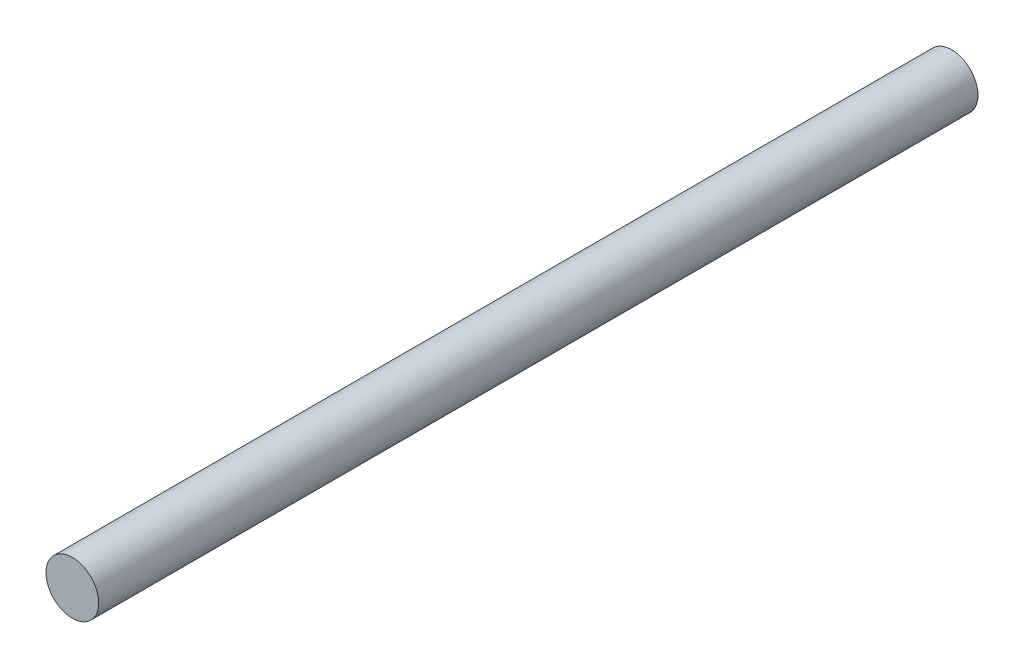
from build123d import *

# Parameters (mm, degrees)
ESBO_O1_R                = 7.5
RESSALTO_EXTRUS_O1_DEPTH = 250


with BuildPart() as part:
    # Esboço1 → Ressalto-extrusão1 (new body)
    with BuildSketch(Plane.XY):
        Circle(ESBO_O1_R)
    extrude(amount=RESSALTO_EXTRUS_O1_DEPTH)


solid = part.part
